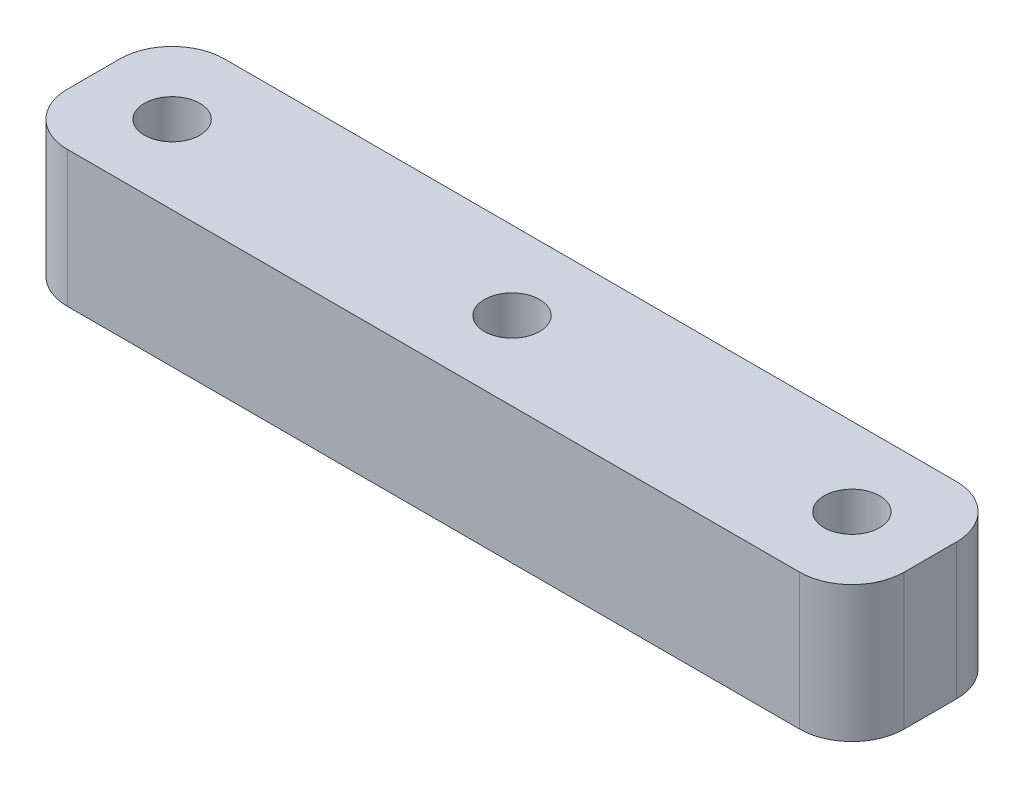
from build123d import *

# Parameters (mm, degrees)
SKETCH1_W            = 80
SKETCH1_H            = 15
BOSS_EXTRUDE1_DEPTH  = 13
M5_CLEARANCE_HOLE1_D = 5.3
FILLET1_R            = 5


with BuildPart() as part:
    # Sketch1 → Boss-Extrude1 (new body)
    with BuildSketch(Plane(origin=(0, 0, 0), x_dir=(1, 0, 0), z_dir=(0, 1, 0))):
        Rectangle(SKETCH1_W, SKETCH1_H)
    extrude(amount=-BOSS_EXTRUDE1_DEPTH)

    # M5 Clearance Hole1 (through all)
    with Locations(Plane(origin=(-32.5, 0, 0), x_dir=(0, 0, 1), z_dir=(0, 1, 0))):
        with Locations((0, 0), (0, 32.5), (0, 65)):
            Hole(M5_CLEARANCE_HOLE1_D / 2)

    # Fillet1
    fillet1_edges = [part.edges().sort_by_distance(p)[0] for p in [
        (-40, -6.5, -7.5),
        (40, -6.5, -7.5),
        (40, -6.5, 7.5),
        (-40, -6.5, 7.5),
    ]]
    fillet(fillet1_edges, radius=FILLET1_R)


solid = part.part
